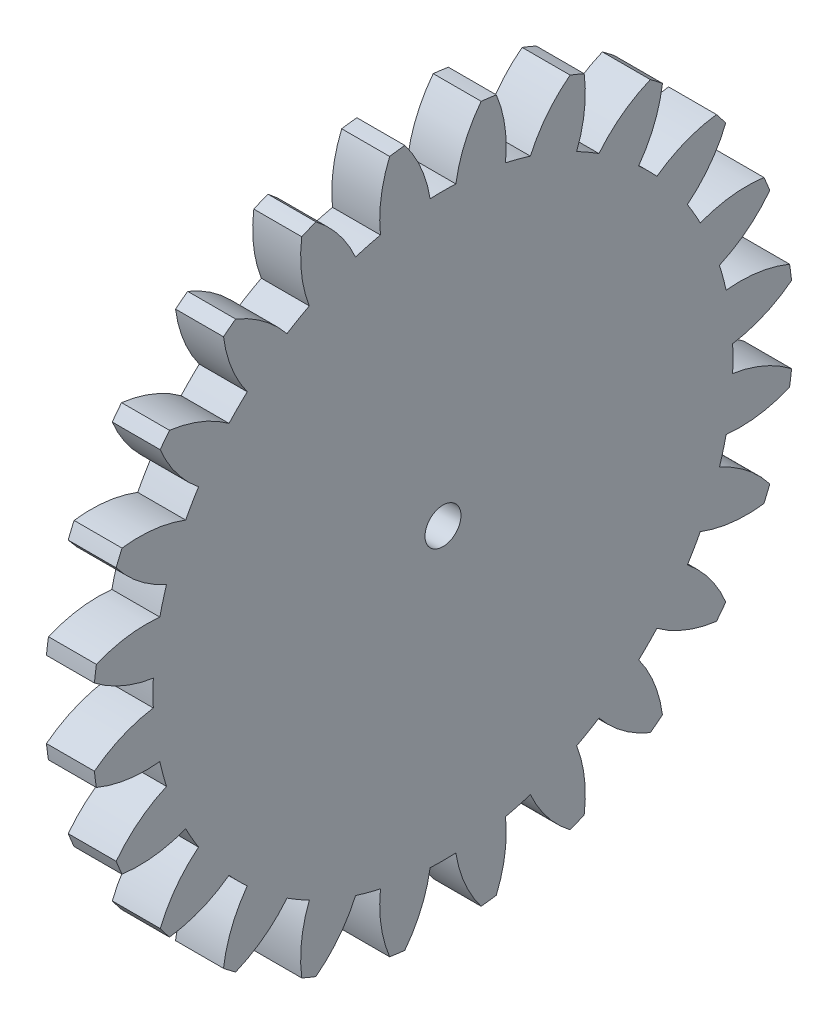
from build123d import *

# Parameters (mm, degrees)
BASPROSKE_W     = 4
BASPROSKE_H     = 29.25
TOOTHCUT_DEPTH  = 42.558693435
TEETHCUTS_COUNT = 24
TEETHCUTS_ANGLE = 345
BORSKE_R        = 1.5
BORE_DEPTH      = 50.0000508


with BuildPart() as part:
    # BasProSke → Base-Revolve (revolve)
    with BuildSketch(Plane(origin=(0, 0, 0), x_dir=(1, 0, 0), z_dir=(0, 1, 0)), mode=Mode.PRIVATE) as base_revolve_sk:
        with Locations((2, 14.625)):
            Rectangle(BASPROSKE_W, BASPROSKE_H)
    revolve(base_revolve_sk.sketch.rotate(Axis((-10, 0, 0), (1, 0, 0)), 180), axis=Axis((-10, 0, 0), (1, 0, 0)))

    # TooCutSke → ToothCut (cut, through all)
    with BuildSketch(Plane(origin=(0, 0, 0), x_dir=(0, 0, -1), z_dir=(1, 0, 0))):
        with BuildLine():
            ThreePointArc((1.074618497, 24.162615283), (0, 24.1865), (-1.074618497, 24.162615283))
            ThreePointArc((-1.074618497, 24.162615283), (-1.826761836, 26.765693566), (-3.203149857, 29.099637045))
            ThreePointArc((-3.203149857, 29.099637045), (0, 29.2754), (3.203149857, 29.099637045))
            ThreePointArc((3.203149857, 29.099637045), (1.826761836, 26.765693566), (1.074618497, 24.162615283))
        make_face()
    toothcut = extrude(amount=TOOTHCUT_DEPTH, mode=Mode.SUBTRACT)

    # TeethCuts: ToothCut ×24 about axis
    teethcuts_axis = Axis((-10, 0, 0), (1, 0, 0))
    for i in range(1, TEETHCUTS_COUNT):
        add(toothcut.rotate(teethcuts_axis, i * TEETHCUTS_ANGLE / (TEETHCUTS_COUNT - 1)), mode=Mode.SUBTRACT)

    # BorSke → Bore (cut, symmetric)
    with BuildSketch(Plane(origin=(0, 0, 0), x_dir=(0, 0, -1), z_dir=(1, 0, 0))):
        with Locations(Location((0, 0, 0), (0, 0, 180))):
            Circle(BORSKE_R)
    extrude(amount=BORE_DEPTH, both=True, mode=Mode.SUBTRACT)


solid = part.part
